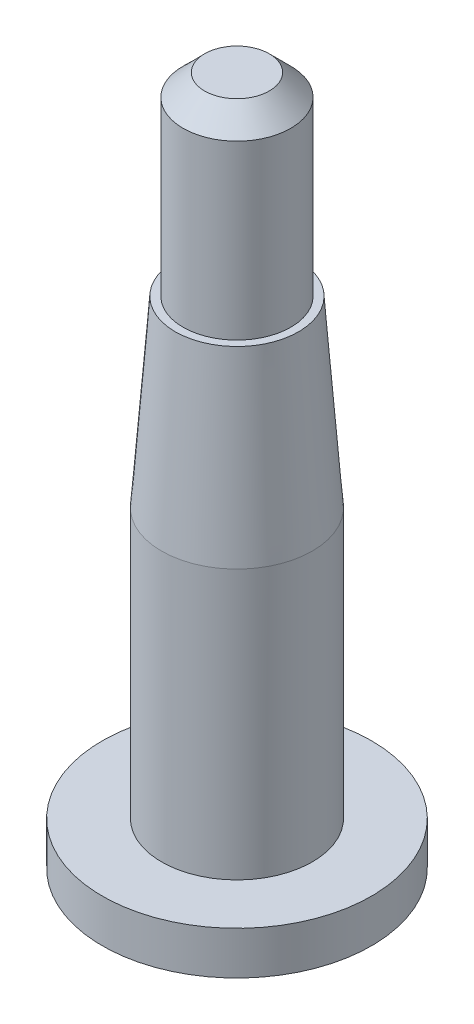
from build123d import *

# Parameters (mm, degrees)
SKETCH2_R           = 7
BOSS_EXTRUDE1_DEPTH = 25
SKETCH3_R           = 7
BOSS_EXTRUDE2_DEPTH = 17
BOSS_EXTRUDE2_TAPER = 4.289
SKETCH4_R           = 5
BOSS_EXTRUDE3_DEPTH = 18
CHAMFER1_SIZE       = 2
SKETCH5_R           = 12.5
BOSS_EXTRUDE4_DEPTH = 4


with BuildPart() as part:
    # Sketch2 → Boss-Extrude1 (new body)
    with BuildSketch(Plane(origin=(0, 0, 0), x_dir=(1, 0, 0), z_dir=(0, 1, 0))):
        with Locations(Location((0, 0, 0), (0, 0, 270))):
            Circle(SKETCH2_R)
    extrude(amount=BOSS_EXTRUDE1_DEPTH)

    # Sketch3 → Boss-Extrude2 (add)
    with BuildSketch(Plane(origin=(0, 25, 0), x_dir=(1, 0, 0), z_dir=(0, 1, 0))):
        with Locations(Location((0, 0, 0), (0, 0, 270))):
            Circle(SKETCH3_R)
    extrude(amount=BOSS_EXTRUDE2_DEPTH, taper=BOSS_EXTRUDE2_TAPER)

    # Sketch4 → Boss-Extrude3 (add)
    with BuildSketch(Plane(origin=(0, 42, 0), x_dir=(1, 0, 0), z_dir=(0, 1, 0))):
        with Locations(Location((0, 0, 0), (0, 0, 270))):
            Circle(SKETCH4_R)
    extrude(amount=BOSS_EXTRUDE3_DEPTH)

    # Chamfer1
    chamfer1_edges = [part.edges().sort_by_distance(p)[0] for p in [
        (0, 60, -5),
    ]]
    chamfer(chamfer1_edges, length=CHAMFER1_SIZE)

    # Sketch5 → Boss-Extrude4 (add)
    with BuildSketch(Plane.XZ):
        with Locations(Location((0, 0, 0), (0, 0, 270))):
            Circle(SKETCH5_R)
    extrude(amount=BOSS_EXTRUDE4_DEPTH)


solid = part.part
